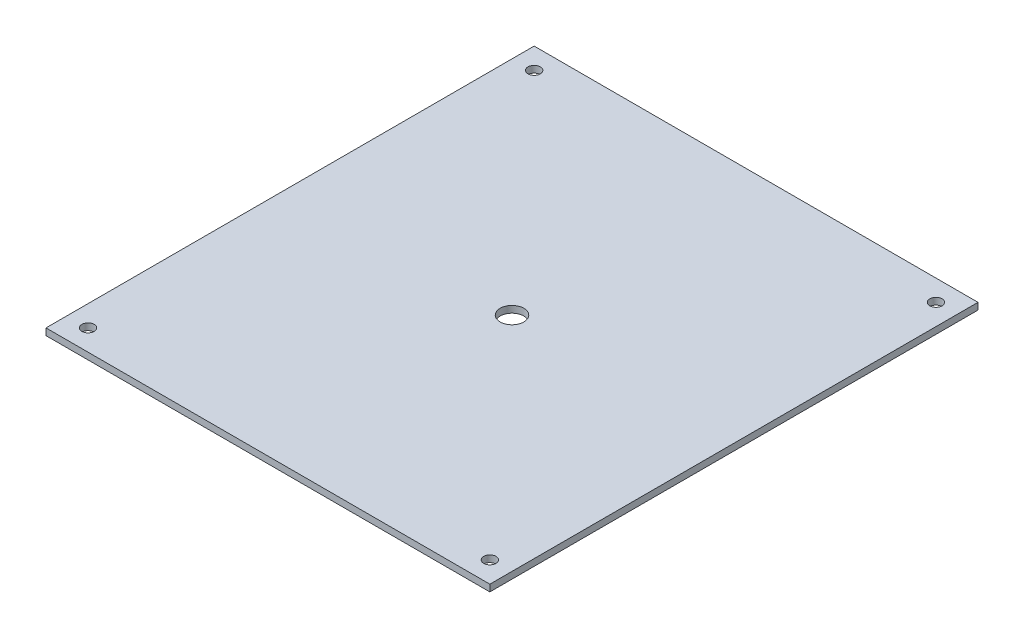
from build123d import *

# Parameters (mm, degrees)
SKETCH1_W           = 140.3
SKETCH1_H           = 154.3
BOSS_EXTRUDE1_DEPTH = 2.13
SKETCH2_R           = 1.94
CUT_EXTRUDE1_DEPTH  = 31.13
SKETCH3_R           = 3.75
CUT_EXTRUDE2_DEPTH  = 20


with BuildPart() as part:
    # Sketch1 → Boss-Extrude1 (new body)
    with BuildSketch(Plane(origin=(0, 0, 0), x_dir=(1, 0, 0), z_dir=(0, 1, 0))):
        Rectangle(SKETCH1_W, SKETCH1_H)
    extrude(amount=BOSS_EXTRUDE1_DEPTH)

    # Sketch2 → Cut-Extrude1 (cut)
    with BuildSketch(Plane(origin=(0, 0, 0), x_dir=(1, 0, 0), z_dir=(0, 1, 0))):
        with Locations(Location((-63.5, -70.5, 0), (0, 0, 270))):
            Circle(SKETCH2_R)
        with Locations(Location((63.5, -70.5, 0), (0, 0, 270))):
            Circle(SKETCH2_R)
        with Locations(Location((-63.5, 70.5, 0), (0, 0, 270))):
            Circle(SKETCH2_R)
        with Locations(Location((63.5, 70.5, 0), (0, 0, 270))):
            Circle(SKETCH2_R)
    extrude(amount=CUT_EXTRUDE1_DEPTH, mode=Mode.SUBTRACT)

    # Sketch3 → Cut-Extrude2 (cut)
    with BuildSketch(Plane(origin=(0, 0, 0), x_dir=(1, 0, 0), z_dir=(0, 1, 0))):
        with Locations(Location((0, 0, 0), (0, 0, 270))):
            Circle(SKETCH3_R)
    extrude(amount=CUT_EXTRUDE2_DEPTH, mode=Mode.SUBTRACT)


solid = part.part
